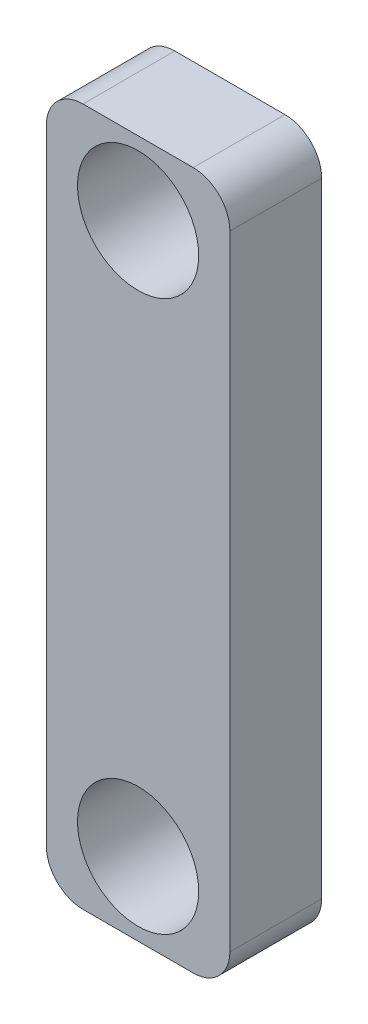
from build123d import *

# Parameters (mm, degrees)
SKETCH_1_W      = 50
SKETCH_1_H      = 190
SKETCH_1_R      = 16.5
EXTRUDE_1_DEPTH = 25
FILLET_1_R      = 10


with BuildPart() as part:
    # 草图1 → 凸台-拉伸1 (new body)
    with BuildSketch(Plane.XY):
        with Locations((25, 95)):
            Rectangle(SKETCH_1_W, SKETCH_1_H)
        with Locations((25, 170)):
            Circle(SKETCH_1_R, mode=Mode.SUBTRACT)
        with Locations((25, 20)):
            Circle(SKETCH_1_R, mode=Mode.SUBTRACT)
    extrude(amount=EXTRUDE_1_DEPTH)

    # 圆角1
    fillet_1_edges = [part.edges().sort_by_distance(p)[0] for p in [
        (0, 190, 12.5),
        (50, 190, 12.5),
        (50, 0, 12.5),
        (0, 0, 12.5),
    ]]
    fillet(fillet_1_edges, radius=FILLET_1_R)


solid = part.part
